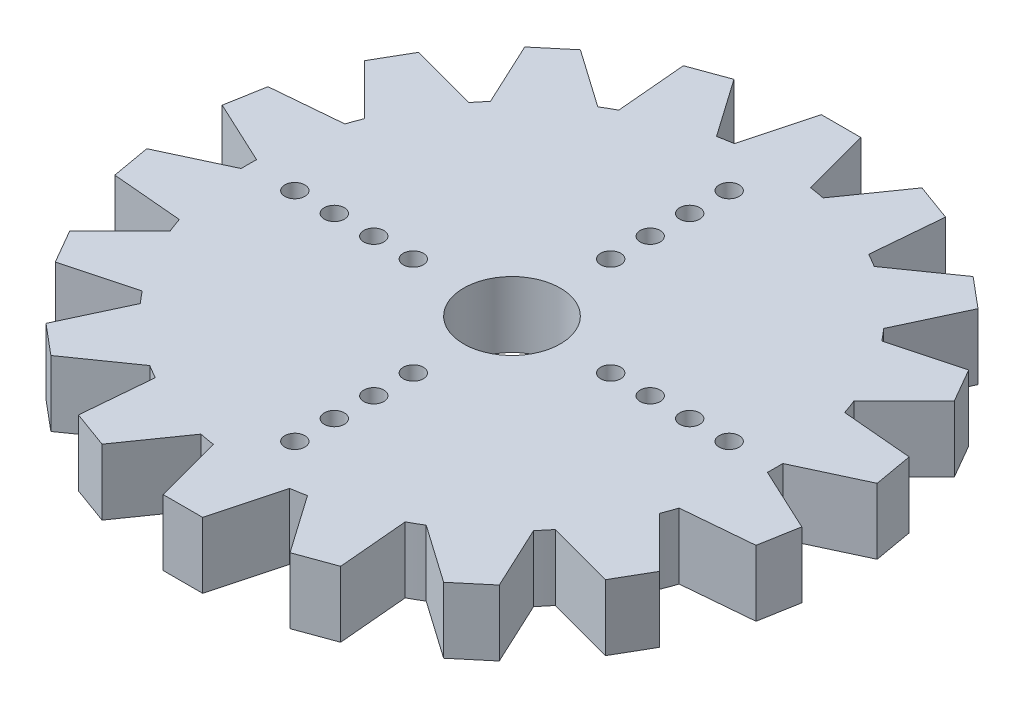
from build123d import *

# Parameters (mm, degrees)
SKETCH2_R           = 20
BOSS_EXTRUDE1_DEPTH = 5
BOSS_EXTRUDE2_DEPTH = 5
CIRPATTERN1_COUNT   = 18
SKETCH3_R           = 3.675
SKETCH3_R_2         = 0.762
CUT_EXTRUDE1_DEPTH  = 36.623693592
CIRPATTERN2_COUNT   = 4


with BuildPart() as part:
    # Sketch2 → Boss-Extrude1 (new body)
    with BuildSketch(Plane(origin=(0, 0, 0), x_dir=(1, 0, 0), z_dir=(0, 1, 0))):
        Circle(SKETCH2_R)
    extrude(amount=BOSS_EXTRUDE1_DEPTH)

    # Sketch2<3> → Boss-Extrude2 (add)
    with BuildSketch(Plane(origin=(0, 0, 0), x_dir=(1, 0, 0), z_dir=(0, 1, 0))):
        with BuildLine():
            ThreePointArc((-2.896233759, 19.789184673), (0, 20), (2.896233759, 19.789184673))
            Line((2.896233759, 19.789184673), (1.5, 25))
            Line((1.5, 25), (-1.5, 25))
            Line((-1.5, 25), (-2.896233759, 19.789184673))
        make_face()
    boss_extrude2 = extrude(amount=BOSS_EXTRUDE2_DEPTH)

    # CirPattern1: Boss-Extrude2 ×18 about axis
    cirpattern1_axis = Axis((0, 5, 0), (0, -1, 0))
    for i in range(1, CIRPATTERN1_COUNT):
        add(boss_extrude2.rotate(cirpattern1_axis, i * 360 / CIRPATTERN1_COUNT))

    # Sketch3 → Cut-Extrude1 (cut, through all)
    with BuildSketch(Plane(origin=(0, 0, 0), x_dir=(1, 0, 0), z_dir=(0, 1, 0))):
        Circle(SKETCH3_R)
        with Locations((7.5, 0)):
            Circle(SKETCH3_R_2)
        with Locations((10.5, 0)):
            Circle(SKETCH3_R_2)
        with Locations((13.5, 0)):
            Circle(SKETCH3_R_2)
        with Locations((16.5, 0)):
            Circle(SKETCH3_R_2)
    cut_extrude1 = extrude(amount=CUT_EXTRUDE1_DEPTH, mode=Mode.SUBTRACT)

    # CirPattern2: Cut-Extrude1 ×4 about axis
    cirpattern2_axis = Axis((0, 5, 0), (0, -1, 0))
    for i in range(1, CIRPATTERN2_COUNT):
        add(cut_extrude1.rotate(cirpattern2_axis, i * 360 / CIRPATTERN2_COUNT), mode=Mode.SUBTRACT)


solid = part.part
